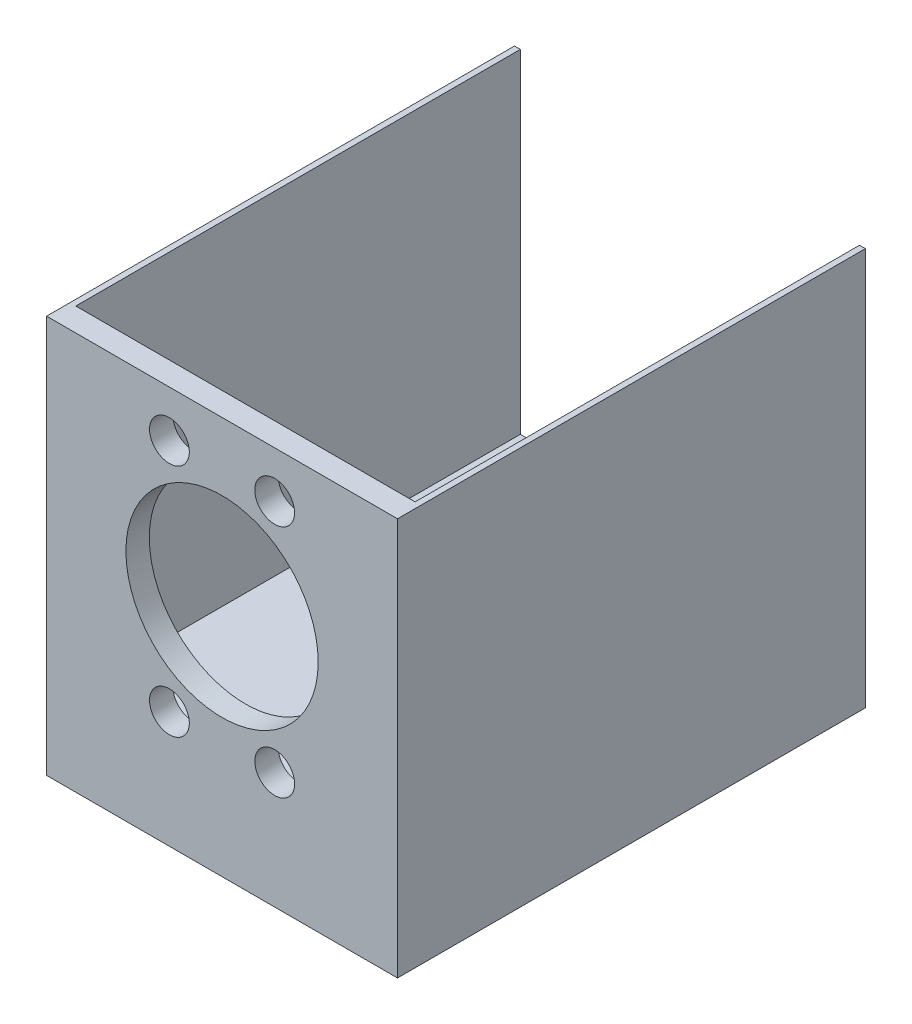
from build123d import *

# Parameters (mm, degrees)
SKETCH1_W                                            = 30
SKETCH1_H                                            = 30
BOSS_EXTRUDE1_DEPTH                                  = 40
SKETCH7_W                                            = 29
SKETCH7_H                                            = 29
CUT_EXTRUDE5_DEPTH                                   = 38
CSK_FOR_M3_CROSS_COUNTERSUNK_HEAD_SCREW1_D           = 3.4
CSK_FOR_M3_CROSS_COUNTERSUNK_HEAD_SCREW1_CSINK_D     = 6
CSK_FOR_M3_CROSS_COUNTERSUNK_HEAD_SCREW1_CSINK_ANGLE = 92
SKETCH18_W                                           = 30
SKETCH18_H                                           = 40
CUT_EXTRUDE6_DEPTH                                   = 1
SKETCH19_R                                           = 1.55
CUT_EXTRUDE7_DEPTH                                   = 1
CUT_EXTRUDE8_DEPTH                                   = 46.276925691
CUT_EXTRUDE8_DEPTH_BACK                              = 46.276925691
SKETCH20_R                                           = 8.2177971
SKETCH22_R                                           = 1.5
SKETCH22_R_2                                         = 1.517998986
BOSS_EXTRUDE2_DEPTH                                  = 5


with BuildPart() as part:
    # Sketch1 → Boss-Extrude1 (new body)
    with BuildSketch(Plane.XY):
        Rectangle(SKETCH1_W, SKETCH1_H)
    extrude(amount=-BOSS_EXTRUDE1_DEPTH)

    # Sketch7 → Cut-Extrude5 (cut)
    with BuildSketch(Plane(origin=(0, 0, -40), x_dir=(-1, 0, 0), z_dir=(0, 0, -1))):
        Rectangle(SKETCH7_W, SKETCH7_H)
    extrude(amount=-CUT_EXTRUDE5_DEPTH, mode=Mode.SUBTRACT)

    # CSK for M3 Cross Countersunk Head Screw1 (through all)
    with Locations(Plane(origin=(0, 0, -40), x_dir=(1, 0, 0), z_dir=(0, 0, -1))):
        with Locations((-4.5, -10.03742995), (4.5, -10.03742995), (4.5, 10.03742995), (-4.5, 10.03742995)):
            CounterSinkHole(CSK_FOR_M3_CROSS_COUNTERSUNK_HEAD_SCREW1_D / 2, CSK_FOR_M3_CROSS_COUNTERSUNK_HEAD_SCREW1_CSINK_D / 2, counter_sink_angle=CSK_FOR_M3_CROSS_COUNTERSUNK_HEAD_SCREW1_CSINK_ANGLE)

    # Sketch18 → Cut-Extrude6 (cut)
    with BuildSketch(Plane(origin=(0, 15, 0), x_dir=(1, 0, 0), z_dir=(0, 1, 0))):
        with Locations((0, 20)):
            Rectangle(SKETCH18_W, SKETCH18_H)
    extrude(amount=-CUT_EXTRUDE6_DEPTH, mode=Mode.SUBTRACT)

    # Sketch19 → Cut-Extrude7 (cut)
    with BuildSketch(Plane.XZ.offset(15)):
        with Locations(Location((-12, -5, 0), (0, 0, 270))):
            Circle(SKETCH19_R)
        with Locations(Location((-12, -37, 0), (0, 0, 270))):
            Circle(SKETCH19_R)
        with Locations(Location((12, -37, 0), (0, 0, 270))):
            Circle(SKETCH19_R)
        with Locations(Location((12, -5, 0), (0, 0, 270))):
            Circle(SKETCH19_R)
    extrude(amount=-CUT_EXTRUDE7_DEPTH, mode=Mode.SUBTRACT)

    # Sketch20 → Cut-Extrude8 (cut, two sides: drawn at the far end of the back side and taken through both)
    with BuildSketch(Plane.XY.offset(-CUT_EXTRUDE8_DEPTH_BACK)):
        Circle(SKETCH20_R)
    extrude(amount=CUT_EXTRUDE8_DEPTH + CUT_EXTRUDE8_DEPTH_BACK, mode=Mode.SUBTRACT)

    # Sketch22 → Boss-Extrude2 (add)
    with BuildSketch(Plane.XZ.offset(15)):
        Polygon((15, -40), (14.5, -40), (-14.5, -40), (-15, -40), (-15, 0), (15, 0), align=None)
        with Locations(Location((-12, -5, 0), (0, 0, 270))):
            Circle(SKETCH22_R, mode=Mode.SUBTRACT)
        with Locations(Location((12, -5, 0), (0, 0, 270))):
            Circle(SKETCH22_R_2, mode=Mode.SUBTRACT)
        with Locations(Location((-12, -37, 0), (0, 0, 270))):
            Circle(SKETCH22_R, mode=Mode.SUBTRACT)
        with Locations(Location((12, -37, 0), (0, 0, 270))):
            Circle(SKETCH22_R, mode=Mode.SUBTRACT)
    extrude(amount=BOSS_EXTRUDE2_DEPTH)


solid = part.part
